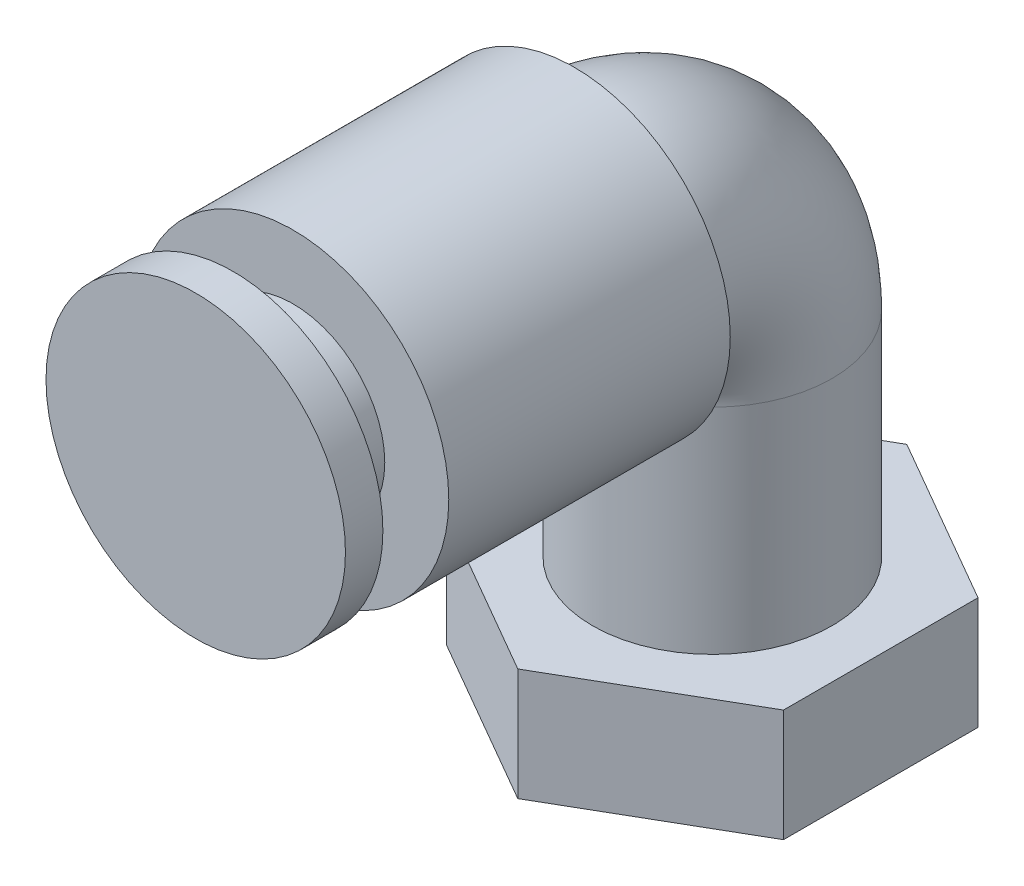
from build123d import *

# Parameters (mm, degrees)
BOSS_EXTRUDE1_DEPTH = 4.7625
SKETCH2_R           = 5.08
SKETCH4_R           = 6.604
BOSS_EXTRUDE2_DEPTH = 11.938
SKETCH5_R           = 3.889836973
BOSS_EXTRUDE3_DEPTH = 2.54
SKETCH6_R           = 6.35
BOSS_EXTRUDE4_DEPTH = 1.5875


with BuildPart() as part:
    # Sketch1 → Boss-Extrude1 (new body)
    with BuildSketch(Plane(origin=(0, 0, 0), x_dir=(1, 0, 0), z_dir=(0, 1, 0))):
        Polygon((0, 8.248891971), (-7.14375, 4.124445986), (-7.14375, -4.124445986), (0, -8.248891971), (7.14375, -4.124445986), (7.14375, 4.124445986), align=None)
    extrude(amount=BOSS_EXTRUDE1_DEPTH)

    # Sweep3: sweep along a path in Sketch3
    with BuildLine(Plane(origin=(0, 0, 0), x_dir=(0, 0, -1), z_dir=(1, 0, 0))) as sweep3_path:
        Line((0, 4.7625), (0, 13.843))
        ThreePointArc((0, 13.843), (-1.52509499, 17.52490501), (-5.207, 19.05))
        Line((-5.207, 19.05), (-17.78, 19.05))
    # Sketch2 → Sweep3 (sweep)
    with BuildSketch(Plane(origin=(0, 4.7625, 0), x_dir=(1, 0, 0), z_dir=(0, 1, 0))):
        Circle(SKETCH2_R)
    sweep(path=sweep3_path.line)

    # Sketch4 → Boss-Extrude2 (add)
    with BuildSketch(Plane.XY.offset(17.78)):
        with Locations((0, 19.05)):
            Circle(SKETCH4_R)
    extrude(amount=-BOSS_EXTRUDE2_DEPTH)

    # Sketch5 → Boss-Extrude3 (add)
    with BuildSketch(Plane.XY.offset(17.78)):
        with Locations((0, 19.05)):
            Circle(SKETCH5_R)
    extrude(amount=BOSS_EXTRUDE3_DEPTH)

    # Sketch6 → Boss-Extrude4 (add)
    with BuildSketch(Plane.XY.offset(20.32)):
        with Locations((0, 19.05)):
            Circle(SKETCH6_R)
    extrude(amount=BOSS_EXTRUDE4_DEPTH)


solid = part.part
